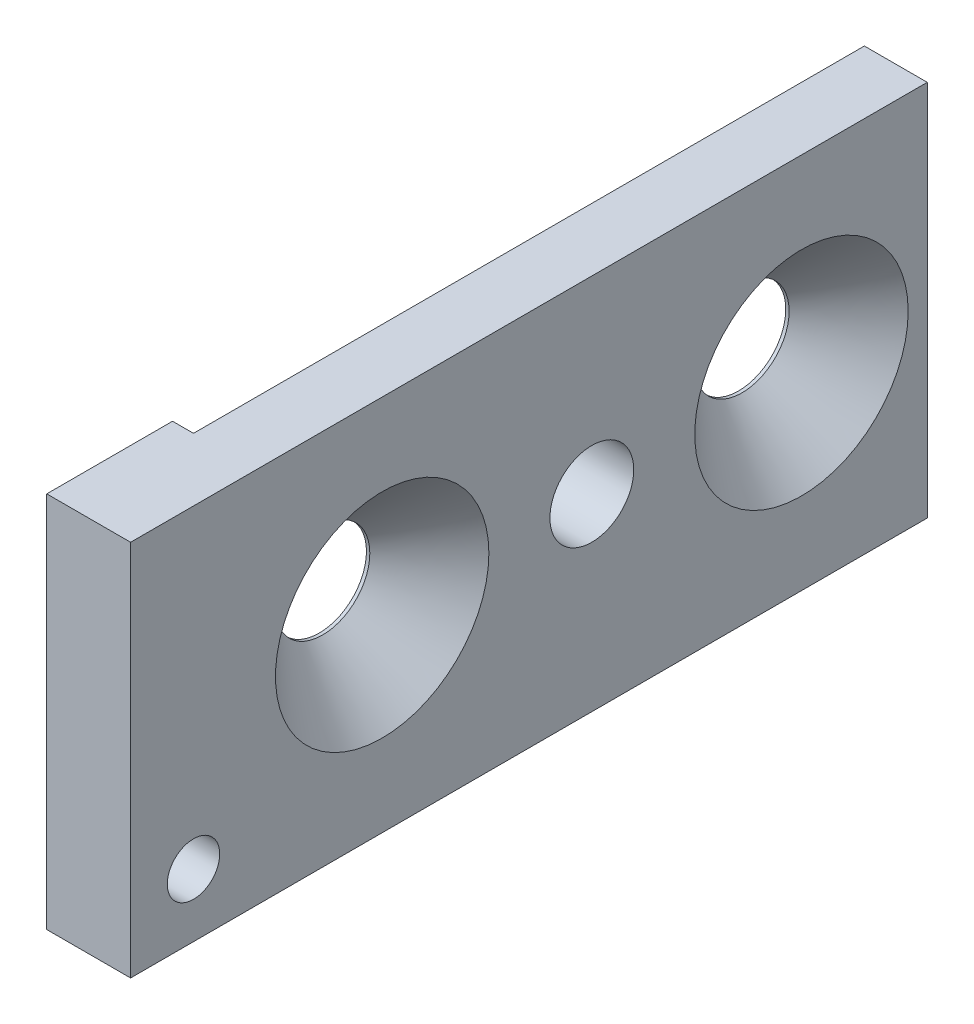
from build123d import *

# Parameters (mm, degrees)
SKETCH1_W                                    = 32
SKETCH1_H                                    = 18
SKETCH1_R                                    = 2
BOSS_EXTRUDE1_DEPTH                          = 3
SKETCH3_W                                    = 4
SKETCH3_H                                    = 18
BOSS_EXTRUDE2_DEPTH                          = 6
SKETCH4_R                                    = 1.25
CUT_EXTRUDE1_DEPTH                           = 25.103941586
CSK_FOR_M4_HEX_SOCKET_COUNTERSUNK_HE_2_COUNT = 2
CSK_FOR_M4_HEX_SOCKET_COUNTERSUNK_HE_2_PITCH = 20


with BuildPart() as part:
    # Sketch1 → Boss-Extrude1 (new body)
    with BuildSketch(Plane(origin=(0, 0, 0), x_dir=(0, 0, -1), z_dir=(1, 0, 0))):
        Rectangle(SKETCH1_W, SKETCH1_H)
        with Locations((-10, 0)):
            Circle(SKETCH1_R, mode=Mode.SUBTRACT)
        Circle(SKETCH1_R, mode=Mode.SUBTRACT)
        with Locations((10, 0)):
            Circle(SKETCH1_R, mode=Mode.SUBTRACT)
    extrude(amount=BOSS_EXTRUDE1_DEPTH)

    # Sketch3 → Boss-Extrude2 (add)
    with BuildSketch(Plane.XY.offset(16)):
        with Locations((1, 0)):
            Rectangle(SKETCH3_W, SKETCH3_H)
    extrude(amount=BOSS_EXTRUDE2_DEPTH)

    # Sketch4 → Cut-Extrude1 (cut, through all)
    with BuildSketch(Plane(origin=(3, 0, 0), x_dir=(0, 0, -1), z_dir=(1, 0, 0))):
        with Locations((-19, -6)):
            Circle(SKETCH4_R)
    extrude(amount=-CUT_EXTRUDE1_DEPTH, mode=Mode.SUBTRACT)

    # Sketch5 → CSK for M4 Hex Socket Countersunk Head Screw1 (revolve, cut)
    with BuildSketch(Plane(origin=(3, 0, 10), x_dir=(0, 0, -1), z_dir=(0, 1, 0))):
        Polygon((0, 0), (0, 4.000025), (2.25, 4.000025), (2.25, 2.84), (5.09, 0), align=None)
    csk_for_m4_hex_socket_countersunk_head_s = revolve(axis=Axis((9.35, 0, 10), (-1, 0, 0)), mode=Mode.SUBTRACT)

    # CSK for M4 Hex Socket Countersunk He 2: CSK for M4 Hex Socket Countersunk Head Screw1 ×2
    with Locations(*[(0, 0, -i * CSK_FOR_M4_HEX_SOCKET_COUNTERSUNK_HE_2_PITCH) for i in range(1, CSK_FOR_M4_HEX_SOCKET_COUNTERSUNK_HE_2_COUNT)]):
        add(csk_for_m4_hex_socket_countersunk_head_s, mode=Mode.SUBTRACT)


solid = part.part
